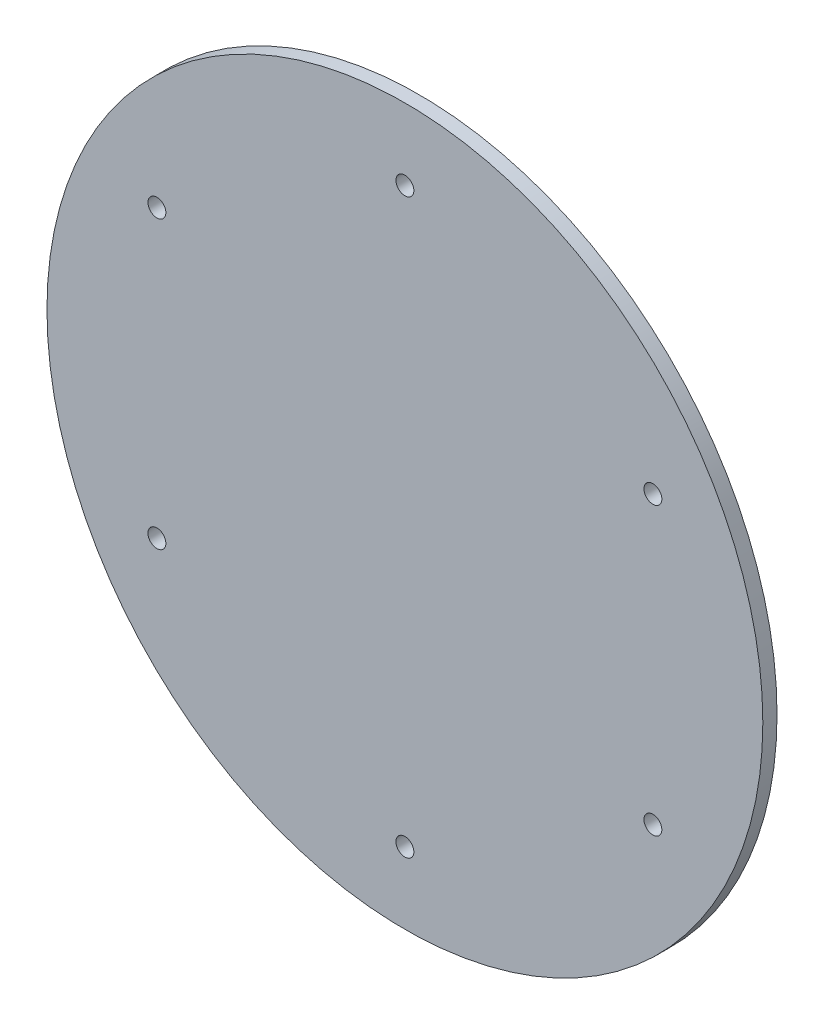
from build123d import *

# Parameters (mm, degrees)
SKETCH1_R           = 80
SKETCH1_R_2         = 2
BOSS_EXTRUDE1_DEPTH = 3.175


with BuildPart() as part:
    # Sketch1 → Boss-Extrude1 (new body)
    with BuildSketch(Plane.XY):
        Circle(SKETCH1_R)
        with Locations((0, 64)):
            Circle(SKETCH1_R_2, mode=Mode.SUBTRACT)
        with Locations((55.425625842, 32)):
            Circle(SKETCH1_R_2, mode=Mode.SUBTRACT)
        with Locations((55.425625842, -32)):
            Circle(SKETCH1_R_2, mode=Mode.SUBTRACT)
        with Locations((0, -64)):
            Circle(SKETCH1_R_2, mode=Mode.SUBTRACT)
        with Locations((-55.425625842, -32)):
            Circle(SKETCH1_R_2, mode=Mode.SUBTRACT)
        with Locations((-55.425625842, 32)):
            Circle(SKETCH1_R_2, mode=Mode.SUBTRACT)
    extrude(amount=BOSS_EXTRUDE1_DEPTH)


solid = part.part
